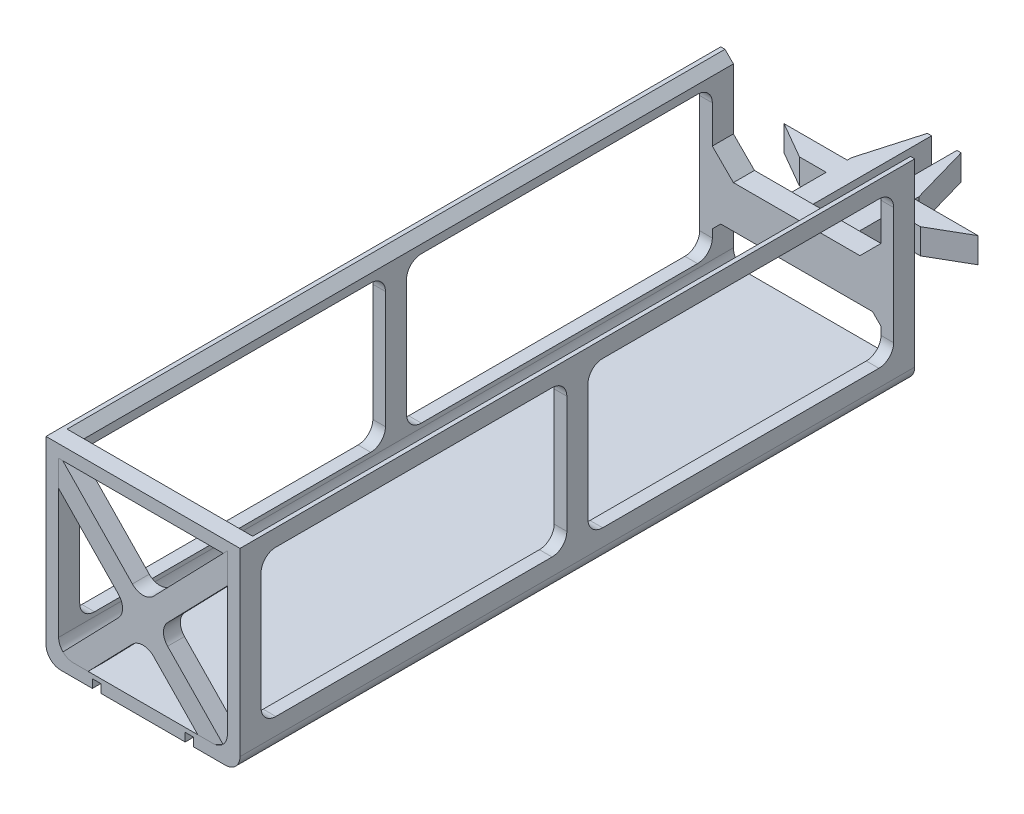
from build123d import *

# Parameters (mm, degrees)
EXTRUDE_1_DEPTH     = 160
CUT_EXTRUDE_1_DEPTH = 160
CHAMFER_1_SIZE      = 2
EXTRUDE_3_DEPTH     = 4
FILLET_1_R          = 3.5
SKETCH_4_W          = 46
SKETCH_4_H          = 3
EXTRUDE_4_DEPTH     = 4
SKETCH_5_W          = 46
SKETCH_5_H          = 10
EXTRUDE_5_DEPTH     = 5
CHAMFER_2_SIZE      = 2
EXTRUDE_6_DEPTH     = 6
CHAMFER_3_SIZE      = 5
SKETCH_8_W          = 2
SKETCH_8_H          = 2
CUT_EXTRUDE_2_DEPTH = 172.232943631


with BuildPart() as part:
    # 草图1 → 凸台-拉伸1 (new body)
    with BuildSketch(Plane.XY):
        with BuildLine():
            Line((0, 43.263390812), (-3, 43.263390812))
            Line((-3, 43.263390812), (-3, 0.5))
            ThreePointArc((-3, 0.5), (-1.974873734, -1.974873734), (0.5, -3))
            Line((0.5, -3), (39.5, -3))
            ThreePointArc((39.5, -3), (41.974873734, -1.974873734), (43, 0.5))
            Line((43, 0.5), (43, 43.263390812))
            Line((43, 43.263390812), (40, 43.263390812))
            Line((40, 43.263390812), (40, 3.5))
            ThreePointArc((40, 3.5), (38.974873734, 1.025126266), (36.5, 0))
            Line((36.5, 0), (3.5, 0))
            ThreePointArc((3.5, 0), (1.025126266, 1.025126266), (0, 3.5))
            Line((0, 3.5), (0, 43.263390812))
        make_face()
    extrude(amount=EXTRUDE_1_DEPTH)

    # 草图2 → 切除-拉伸1 (cut)
    with BuildSketch(Plane.ZY.offset(3)):
        with BuildLine():
            Line((8.5, 39.263390812), (74, 39.263390812))
            ThreePointArc((74, 39.263390812), (76.474873734, 38.238264546), (77.5, 35.763390812))
            Line((77.5, 35.763390812), (77.5, 8))
            ThreePointArc((77.5, 8), (76.474873734, 5.525126266), (74, 4.5))
            Line((74, 4.5), (8.5, 4.5))
            ThreePointArc((8.5, 4.5), (6.025126266, 5.525126266), (5, 8))
            Line((5, 8), (5, 35.763390812))
            ThreePointArc((5, 35.763390812), (6.025126266, 38.238264546), (8.5, 39.263390812))
        make_face()
        with BuildLine():
            Line((86, 39.263390812), (151.5, 39.263390812))
            ThreePointArc((151.5, 39.263390812), (153.974873734, 38.238264546), (155, 35.763390812))
            Line((155, 35.763390812), (155, 8))
            ThreePointArc((155, 8), (153.974873734, 5.525126266), (151.5, 4.5))
            Line((151.5, 4.5), (86, 4.5))
            ThreePointArc((86, 4.5), (83.525126266, 5.525126266), (82.5, 8))
            Line((82.5, 8), (82.5, 35.763390812))
            ThreePointArc((82.5, 35.763390812), (83.525126266, 38.238264546), (86, 39.263390812))
        make_face()
    extrude(amount=-CUT_EXTRUDE_1_DEPTH, mode=Mode.SUBTRACT)

    # 倒角1
    chamfer_1_edges = [part.edges().sort_by_distance(p)[0] for p in [
        (40, 43.263390812, 80),
        (0, 43.263390812, 80),
    ]]
    chamfer(chamfer_1_edges, length=CHAMFER_1_SIZE)

    # 草图4 → 凸台-拉伸4 (add)
    with BuildSketch(Plane.XY.offset(160)):
        with Locations((20, 41.763390812)):
            Rectangle(SKETCH_4_W, SKETCH_4_H)
    extrude(amount=-EXTRUDE_4_DEPTH)

    # 草图5 → 凸台-拉伸5 (add)
    with BuildSketch(Plane(origin=(0, 0, 0), x_dir=(-1, 0, 0), z_dir=(0, 0, -1))):
        with Locations((-20, 16.881695406)):
            Rectangle(SKETCH_5_W, SKETCH_5_H)
    extrude(amount=-EXTRUDE_5_DEPTH)

    # 倒角2
    chamfer_2_edges = [part.edges().sort_by_distance(p)[0] for p in [
        (0, 11.881695406, 2.5),
        (40, 11.881695406, 2.5),
    ]]
    chamfer(chamfer_2_edges, length=CHAMFER_2_SIZE)

    # 草图7 → 凸台-拉伸6 (add)
    with BuildSketch(Plane(origin=(0, 14, 0), x_dir=(1, 0, 0), z_dir=(0, 1, 0))):
        Polygon((43, 15), (34.339745962, 10), (28, 10), (28, 0), (23, 0), (23, 30), (24, 30), (28, 16), (28, 15), align=None)
        Polygon((17, 0), (17, 30), (16, 30), (12, 16), (12, 15), (-3, 15), (5.660254038, 10), (12, 10), (12, 0), align=None)
    extrude(amount=EXTRUDE_6_DEPTH)

    # 倒角3
    chamfer_3_edges = [part.edges().sort_by_distance(p)[0] for p in [
        (0, 21.881695406, 2.5),
        (40, 21.881695406, 2.5),
    ]]
    chamfer(chamfer_3_edges, length=CHAMFER_3_SIZE)

    # 草图8 → 切除-拉伸2 (cut, through all)
    with BuildSketch(Plane(origin=(0, 0, 0), x_dir=(-1, 0, 0), z_dir=(0, 0, -1))):
        with Locations((-9, -2)):
            Rectangle(SKETCH_8_W, SKETCH_8_H)
        with Locations((-31, -2)):
            Rectangle(SKETCH_8_W, SKETCH_8_H)
    extrude(amount=-CUT_EXTRUDE_2_DEPTH, mode=Mode.SUBTRACT)


with BuildPart() as body_2:
    # 草图3 → 凸台-拉伸3 (new body)
    with BuildSketch(Plane.XY.offset(160)):
        Polygon((23.480472603, 17.021786472), (20, 20.615080405), (16.519527397, 17.021786472), (20, 13.428492539), align=None)
        Polygon((40, 34.076802945), (40, 41.263390812), (20, 20.615080405), (23.480472603, 17.021786472), align=None)
        with BuildLine():
            Line((38.974873734, 1.025126266), (23.480472603, 17.021786472))
            Line((23.480472603, 17.021786472), (20, 13.428492539))
            Line((20, 13.428492539), (33.00686814, 0))
            Line((33.00686814, 0), (36.5, 0))
            ThreePointArc((36.5, 0), (36.864065208, 0.018986279), (37.224180562, 0.075739129))
            Line((37.224180562, 0.075739129), (38.974873734, 1.025126266))
        make_face()
        with BuildLine():
            Line((20, 13.428492539), (16.519527397, 17.021786472))
            Line((16.519527397, 17.021786472), (1.025126266, 1.025126266))
            Line((1.025126266, 1.025126266), (1.105309781, 0.947460332))
            ThreePointArc((1.105309781, 0.947460332), (2.212344929, 0.245473242), (3.5, 0))
            Line((3.5, 0), (6.99313186, 0))
            Line((6.99313186, 0), (20, 13.428492539))
        make_face()
        Polygon((0.320654638, 40.932341987), (0, 41.263390812), (0, 34.076802945), (16.519527397, 17.021786472), (20, 20.615080405), align=None)
    extrude(amount=-EXTRUDE_3_DEPTH)

    # 圆角1
    fillet_1_edges = [body_2.edges().sort_by_distance(p)[0] for p in [
        (20, 20.615080405, 158),
        (23.480472603, 17.021786472, 158),
        (20, 13.428492539, 158),
        (16.519527397, 17.021786472, 158),
    ]]
    fillet(fillet_1_edges, radius=FILLET_1_R)


solid = Compound([part.part, body_2.part])
